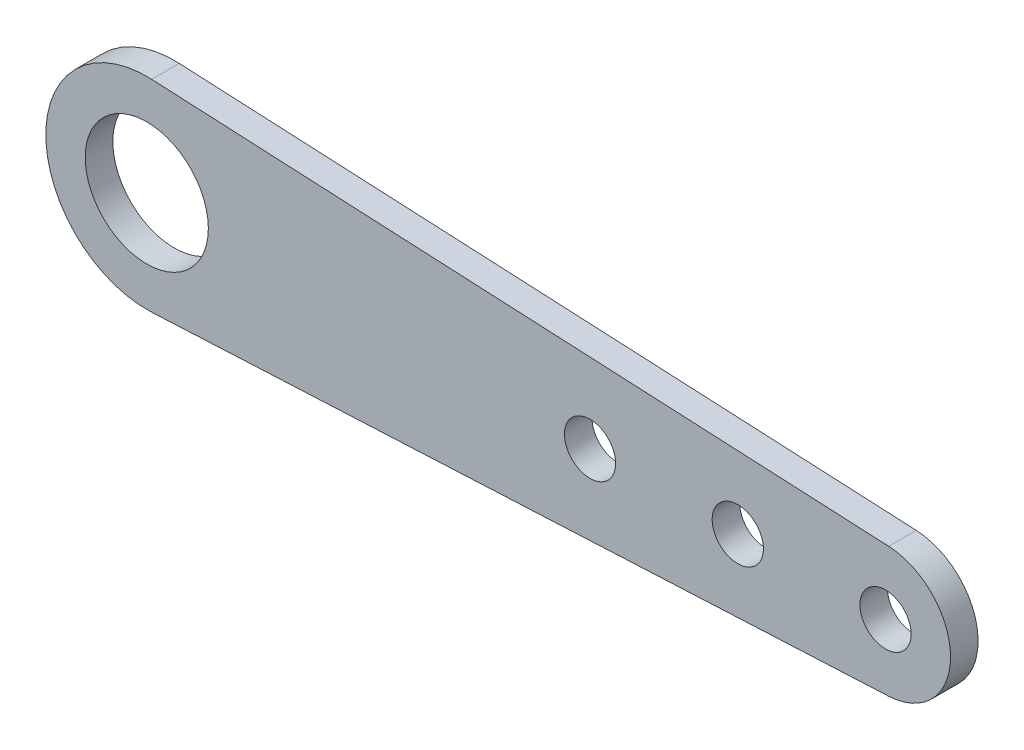
from build123d import *

# Parameters (mm, degrees)
SKETCH1_R          = 7.9375
SKETCH1_R_2        = 3.302
EXTRUDE_BODY_DEPTH = 3.556


with BuildPart() as part:
    # Sketch1 → Extrude - Body (new body)
    with BuildSketch(Plane.XY):
        with BuildLine():
            Line((0.633518333, 13.002075249), (95.657924, 8.372067965))
            ThreePointArc((95.657924, 8.372067965), (103.632, 0), (95.657924, -8.372067965))
            Line((95.657924, -8.372067965), (0.633518333, -13.002075249))
            ThreePointArc((0.633518333, -13.002075249), (-13.0175, 0), (0.633518333, 13.002075249))
        make_face()
        Circle(SKETCH1_R, mode=Mode.SUBTRACT)
        with Locations((57.15, 0)):
            Circle(SKETCH1_R_2, mode=Mode.SUBTRACT)
        with Locations((76.2, 0)):
            Circle(SKETCH1_R_2, mode=Mode.SUBTRACT)
        with Locations((95.25, 0)):
            Circle(SKETCH1_R_2, mode=Mode.SUBTRACT)
    extrude(amount=EXTRUDE_BODY_DEPTH)


solid = part.part
